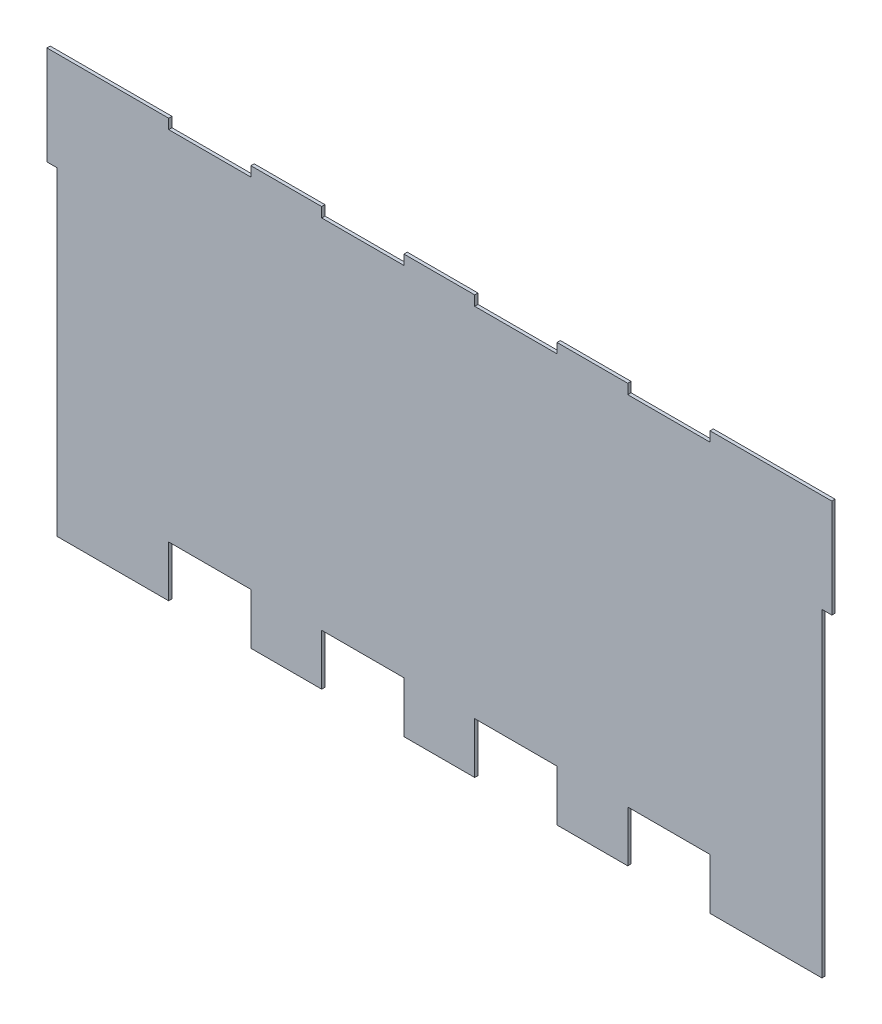
from build123d import *

# Parameters (mm, degrees)
SKETCH1_W           = 465
SKETCH1_H           = 254
BOSS_EXTRUDE1_DEPTH = 2
SKETCH2_W           = 50
SKETCH2_H           = 12
CUT_EXTRUDE1_DEPTH  = 2
SKETCH3_W           = 6
SKETCH3_H           = 60
BOSS_EXTRUDE2_DEPTH = 2
SKETCH4_W           = 50
SKETCH4_H           = 25
CUT_EXTRUDE2_DEPTH  = 2


with BuildPart() as part:
    # Sketch1 → Boss-Extrude1 (new body)
    with BuildSketch(Plane.XY):
        Rectangle(SKETCH1_W, SKETCH1_H)
    extrude(amount=BOSS_EXTRUDE1_DEPTH)

    # Sketch2 → Cut-Extrude1 (cut)
    with BuildSketch(Plane.XY.offset(2)):
        with Locations((-139.5, -127)):
            Rectangle(SKETCH2_W, SKETCH2_H)
        with Locations((-46.5, -127)):
            Rectangle(SKETCH2_W, SKETCH2_H)
        with Locations((46.5, -127)):
            Rectangle(SKETCH2_W, SKETCH2_H)
        with Locations((139.5, -127)):
            Rectangle(SKETCH2_W, SKETCH2_H)
        with Locations((-139.5, 127)):
            Rectangle(SKETCH2_W, SKETCH2_H)
        with Locations((-46.5, 127)):
            Rectangle(SKETCH2_W, SKETCH2_H)
        with Locations((46.5, 127)):
            Rectangle(SKETCH2_W, SKETCH2_H)
        with Locations((139.5, 127)):
            Rectangle(SKETCH2_W, SKETCH2_H)
    extrude(amount=-CUT_EXTRUDE1_DEPTH, mode=Mode.SUBTRACT)

    # Sketch3 → Boss-Extrude2 (add)
    with BuildSketch(Plane.XY.offset(2)):
        with Locations((-235.5, 97)):
            Rectangle(SKETCH3_W, SKETCH3_H)
        with Locations((235.5, 97)):
            Rectangle(SKETCH3_W, SKETCH3_H)
    extrude(amount=-BOSS_EXTRUDE2_DEPTH)

    # Sketch4 → Cut-Extrude2 (cut)
    with BuildSketch(Plane.XY.offset(2)):
        with Locations((-139.5, -108.5)):
            Rectangle(SKETCH4_W, SKETCH4_H)
        with Locations((46.5, -108.5)):
            Rectangle(SKETCH4_W, SKETCH4_H)
        with Locations((139.5, -108.5)):
            Rectangle(SKETCH4_W, SKETCH4_H)
        with Locations((-46.5, -108.5)):
            Rectangle(SKETCH4_W, SKETCH4_H)
    extrude(amount=-CUT_EXTRUDE2_DEPTH, mode=Mode.SUBTRACT)


solid = part.part
